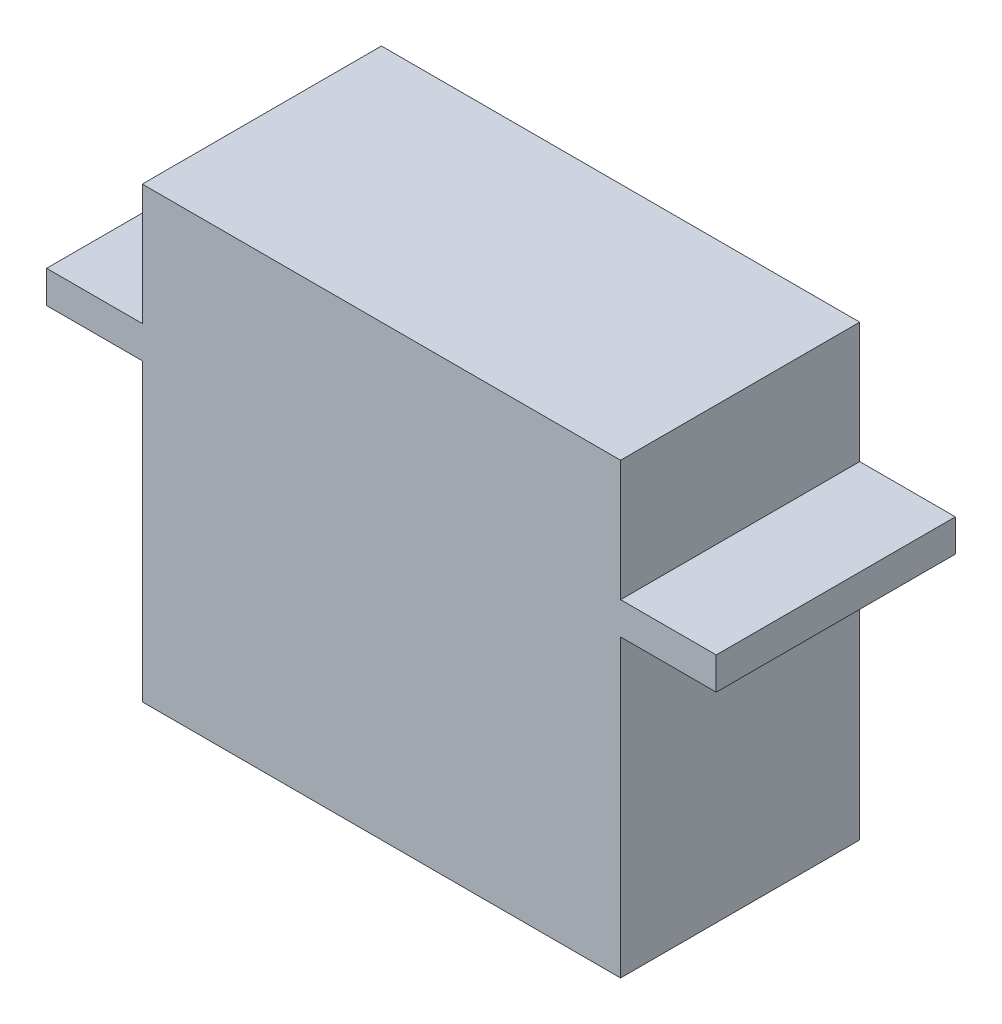
from build123d import *

# Parameters (mm, degrees)
SKETCH1_W           = 8.153779141
SKETCH1_H           = 12.8
SKETCH1_H_2         = 24.7
SKETCH1_W_2         = 40
SKETCH1_W_3         = 7.846220859
BOSS_EXTRUDE1_DEPTH = 20
SKETCH4_W           = 20
SKETCH4_H           = 24.7
CUT_EXTRUDE1_DEPTH  = 8
SKETCH5_W           = 20
SKETCH5_H           = 24.7
CUT_EXTRUDE2_DEPTH  = 8
SKETCH6_W           = 20
SKETCH6_H           = 10.1
CUT_EXTRUDE3_DEPTH  = 8
SKETCH7_W           = 20
SKETCH7_H           = 10.1
CUT_EXTRUDE4_DEPTH  = 8


with BuildPart() as part:
    # Sketch1 → Boss-Extrude1 (new body)
    with BuildSketch(Plane.XY):
        with Locations((4.076889571, 31.1)):
            Rectangle(SKETCH1_W, SKETCH1_H)
        with Locations((4.076889571, 12.35)):
            Rectangle(SKETCH1_W, SKETCH1_H_2)
        with Locations((28.153779141, 31.1)):
            Rectangle(SKETCH1_W_2, SKETCH1_H)
        with Locations((28.153779141, 12.35)):
            Rectangle(SKETCH1_W_2, SKETCH1_H_2)
        with Locations((52.076889571, 31.1)):
            Rectangle(SKETCH1_W_3, SKETCH1_H)
        with Locations((52.076889571, 12.35)):
            Rectangle(SKETCH1_W_3, SKETCH1_H_2)
    extrude(amount=BOSS_EXTRUDE1_DEPTH)

    # Sketch4 → Cut-Extrude1 (cut)
    with BuildSketch(Plane.ZY):
        with Locations((10, 12.35)):
            Rectangle(SKETCH4_W, SKETCH4_H)
    extrude(amount=-CUT_EXTRUDE1_DEPTH, mode=Mode.SUBTRACT)

    # Sketch5 → Cut-Extrude2 (cut)
    with BuildSketch(Plane(origin=(56, 0, 0), x_dir=(0, 0, -1), z_dir=(1, 0, 0))):
        with Locations((-10, 12.35)):
            Rectangle(SKETCH5_W, SKETCH5_H)
    extrude(amount=-CUT_EXTRUDE2_DEPTH, mode=Mode.SUBTRACT)

    # Sketch6 → Cut-Extrude3 (cut)
    with BuildSketch(Plane(origin=(56, 0, 0), x_dir=(0, 0, -1), z_dir=(1, 0, 0))):
        with Locations((-10, 32.45)):
            Rectangle(SKETCH6_W, SKETCH6_H)
    extrude(amount=-CUT_EXTRUDE3_DEPTH, mode=Mode.SUBTRACT)

    # Sketch7 → Cut-Extrude4 (cut)
    with BuildSketch(Plane.ZY):
        with Locations((10, 32.45)):
            Rectangle(SKETCH7_W, SKETCH7_H)
    extrude(amount=-CUT_EXTRUDE4_DEPTH, mode=Mode.SUBTRACT)


solid = part.part
